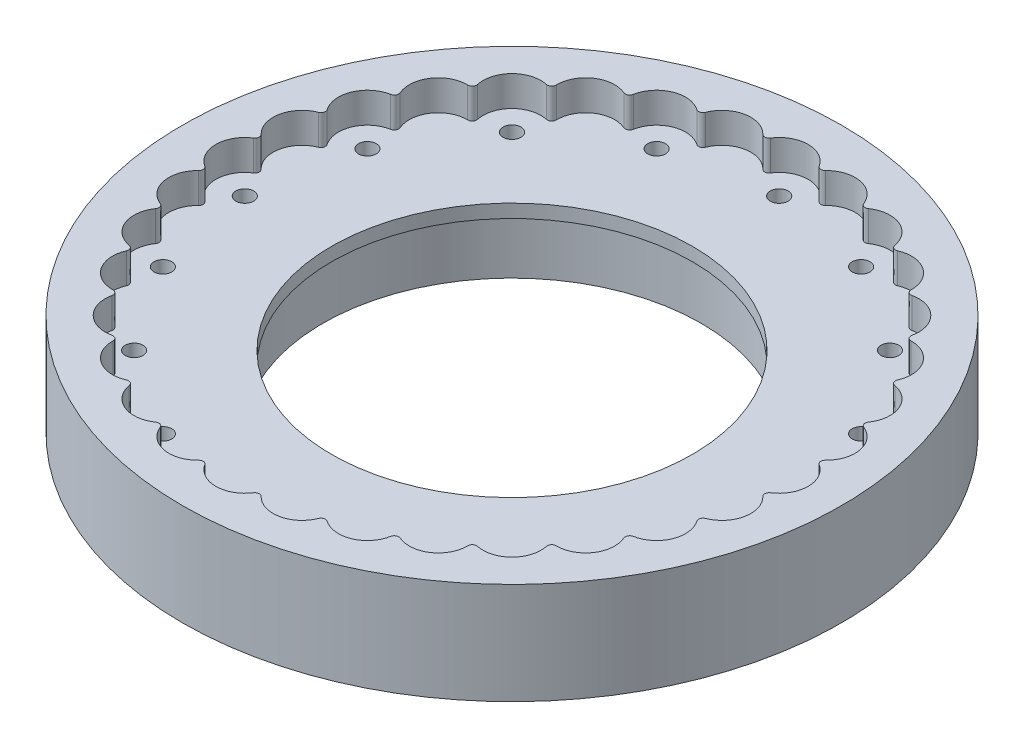
from build123d import *

# Parameters (mm, degrees)
SKETCH_1_R          = 74
EXTRUDE_1_DEPTH     = 6.8
EXTRUDE_START       = 16
SKETCH_2_R          = 74
EXTRUDE_2_DEPTH     = 16
SKETCH_3_R          = 2
CUT_EXTRUDE_1_DEPTH = 16
CUT_EXTRUDE_2_DEPTH = 4.5
FILLET_1_R          = 1
FILLET_2_R          = 1
SKETCH_5_R          = 40.5
CUT_EXTRUDE_5_DEPTH = 110.200915906
SKETCH_6_R          = 42.5
CUT_EXTRUDE_6_DEPTH = 13
SKETCH_8_R          = 2
CUT_EXTRUDE_8_DEPTH = 10


with BuildPart() as part:
    # 草图1 → 凸台-拉伸1 (new body)
    with BuildSketch(Plane(origin=(0, 0, 0), x_dir=(1, 0, 0), z_dir=(0, 1, 0))):
        with Locations(Location((-3, 0, 0), (0, 0, 270))):
            Circle(SKETCH_1_R)
        with BuildLine():
            ThreePointArc((-68.222221147, 12.973506414), (-67.787057046, 9.065890923), (-65.178531856, 6.124050861))
            ThreePointArc((-65.178531856, 6.124050861), (-68.310859491, 3.74763545), (-69.5, 0))
            ThreePointArc((-69.5, 0), (-68.310859491, -3.74763545), (-65.178531856, -6.124050861))
            ThreePointArc((-65.178531856, -6.124050861), (-67.787057046, -9.065890923), (-68.222221147, -12.973506414))
            ThreePointArc((-68.222221147, -12.973506414), (-66.324802233, -16.417142295), (-62.789045747, -18.136808743))
            ThreePointArc((-62.789045747, -18.136808743), (-64.773524332, -21.531020193), (-64.437988912, -25.448448252))
            ThreePointArc((-64.437988912, -25.448448252), (-61.905208337, -28.455747568), (-58.10190014, -29.452579237))
            ThreePointArc((-58.10190014, -29.452579237), (-59.38606972, -33.168724431), (-58.292729218, -36.945420496))
            ThreePointArc((-58.292729218, -36.945420496), (-55.22192032, -39.400814421), (-51.297219412, -39.636503628))
            ThreePointArc((-51.297219412, -39.636503628), (-51.831730071, -43.531773191), (-50.022600949, -47.022600949))
            ThreePointArc((-50.022600949, -47.022600949), (-46.531773191, -48.831730071), (-42.636503628, -48.297219412))
            ThreePointArc((-42.636503628, -48.297219412), (-42.400814421, -52.22192032), (-39.945420496, -55.292729218))
            ThreePointArc((-39.945420496, -55.292729218), (-36.168724431, -56.38606972), (-32.452579237, -55.10190014))
            ThreePointArc((-32.452579237, -55.10190014), (-31.455747568, -58.905208337), (-28.448448252, -61.437988912))
            ThreePointArc((-28.448448252, -61.437988912), (-24.531020193, -61.773524332), (-21.136808743, -59.789045747))
            ThreePointArc((-21.136808743, -59.789045747), (-19.417142295, -63.324802232), (-15.973506414, -65.222221147))
            ThreePointArc((-15.973506414, -65.222221147), (-12.065890923, -64.787057046), (-9.124050861, -62.178531856))
            ThreePointArc((-9.124050861, -62.178531856), (-6.74763545, -65.310859491), (-3, -66.5))
            ThreePointArc((-3, -66.5), (0.74763545, -65.310859491), (3.124050861, -62.178531856))
            ThreePointArc((3.124050861, -62.178531856), (6.065890923, -64.787057046), (9.973506414, -65.222221147))
            ThreePointArc((9.973506414, -65.222221147), (13.417142295, -63.324802232), (15.136808743, -59.789045747))
            ThreePointArc((15.136808743, -59.789045747), (18.531020193, -61.773524332), (22.448448252, -61.437988912))
            ThreePointArc((22.448448252, -61.437988912), (25.455747568, -58.905208337), (26.452579237, -55.10190014))
            ThreePointArc((26.452579237, -55.10190014), (30.168724431, -56.38606972), (33.945420496, -55.292729218))
            ThreePointArc((33.945420496, -55.292729218), (36.400814421, -52.22192032), (36.636503628, -48.297219412))
            ThreePointArc((36.636503628, -48.297219412), (40.531773191, -48.831730071), (44.022600949, -47.022600949))
            ThreePointArc((44.022600949, -47.022600949), (45.831730071, -43.531773191), (45.297219412, -39.636503628))
            ThreePointArc((45.297219412, -39.636503628), (49.22192032, -39.400814421), (52.292729218, -36.945420496))
            ThreePointArc((52.292729218, -36.945420496), (53.38606972, -33.168724431), (52.10190014, -29.452579237))
            ThreePointArc((52.10190014, -29.452579237), (55.905208337, -28.455747568), (58.437988912, -25.448448252))
            ThreePointArc((58.437988912, -25.448448252), (58.773524332, -21.531020193), (56.789045747, -18.136808743))
            ThreePointArc((56.789045747, -18.136808743), (60.324802232, -16.417142295), (62.222221147, -12.973506414))
            ThreePointArc((62.222221147, -12.973506414), (61.787057046, -9.065890923), (59.178531856, -6.124050861))
            ThreePointArc((59.178531856, -6.124050861), (62.310859491, -3.74763545), (63.5, 0))
            ThreePointArc((63.5, 0), (62.310859491, 3.74763545), (59.178531856, 6.124050861))
            ThreePointArc((59.178531856, 6.124050861), (61.787057046, 9.065890923), (62.222221147, 12.973506414))
            ThreePointArc((62.222221147, 12.973506414), (60.324802232, 16.417142295), (56.789045747, 18.136808743))
            ThreePointArc((56.789045747, 18.136808743), (58.773524332, 21.531020193), (58.437988912, 25.448448252))
            ThreePointArc((58.437988912, 25.448448252), (55.905208337, 28.455747568), (52.10190014, 29.452579237))
            ThreePointArc((52.10190014, 29.452579237), (53.38606972, 33.168724431), (52.292729218, 36.945420496))
            ThreePointArc((52.292729218, 36.945420496), (49.22192032, 39.400814421), (45.297219412, 39.636503628))
            ThreePointArc((45.297219412, 39.636503628), (45.831730071, 43.531773191), (44.022600949, 47.022600949))
            ThreePointArc((44.022600949, 47.022600949), (40.531773191, 48.831730071), (36.636503628, 48.297219412))
            ThreePointArc((36.636503628, 48.297219412), (36.400814421, 52.22192032), (33.945420496, 55.292729218))
            ThreePointArc((33.945420496, 55.292729218), (30.168724431, 56.38606972), (26.452579237, 55.10190014))
            ThreePointArc((26.452579237, 55.10190014), (25.455747568, 58.905208337), (22.448448252, 61.437988912))
            ThreePointArc((22.448448252, 61.437988912), (18.531020193, 61.773524332), (15.136808743, 59.789045747))
            ThreePointArc((15.136808743, 59.789045747), (13.417142295, 63.324802232), (9.973506414, 65.222221147))
            ThreePointArc((9.973506414, 65.222221147), (6.065890923, 64.787057046), (3.124050861, 62.178531856))
            ThreePointArc((3.124050861, 62.178531856), (0.74763545, 65.310859491), (-3, 66.5))
            ThreePointArc((-3, 66.5), (-6.74763545, 65.310859491), (-9.124050861, 62.178531856))
            ThreePointArc((-9.124050861, 62.178531856), (-12.065890923, 64.787057046), (-15.973506414, 65.222221147))
            ThreePointArc((-15.973506414, 65.222221147), (-19.417142295, 63.324802232), (-21.136808743, 59.789045747))
            ThreePointArc((-21.136808743, 59.789045747), (-24.531020193, 61.773524332), (-28.448448252, 61.437988912))
            ThreePointArc((-28.448448252, 61.437988912), (-31.455747568, 58.905208337), (-32.452579237, 55.10190014))
            ThreePointArc((-32.452579237, 55.10190014), (-36.168724431, 56.38606972), (-39.945420496, 55.292729218))
            ThreePointArc((-39.945420496, 55.292729218), (-42.400814421, 52.22192032), (-42.636503628, 48.297219412))
            ThreePointArc((-42.636503628, 48.297219412), (-46.531773191, 48.831730071), (-50.022600949, 47.022600949))
            ThreePointArc((-50.022600949, 47.022600949), (-51.831730071, 43.531773191), (-51.297219412, 39.636503628))
            ThreePointArc((-51.297219412, 39.636503628), (-55.22192032, 39.400814421), (-58.292729218, 36.945420496))
            ThreePointArc((-58.292729218, 36.945420496), (-59.38606972, 33.168724431), (-58.10190014, 29.452579237))
            ThreePointArc((-58.10190014, 29.452579237), (-61.905208337, 28.455747568), (-64.437988912, 25.448448252))
            ThreePointArc((-64.437988912, 25.448448252), (-64.773524332, 21.531020193), (-62.789045747, 18.136808743))
            ThreePointArc((-62.789045747, 18.136808743), (-66.324802233, 16.417142295), (-68.222221147, 12.973506414))
        make_face(mode=Mode.SUBTRACT)
    extrude(amount=EXTRUDE_1_DEPTH)

    # 草图2 → 凸台-拉伸2 (add)
    with BuildSketch(Plane.XZ.offset(EXTRUDE_START)):
        with Locations(Location((-3, 0, 0), (0, 0, 270))):
            Circle(SKETCH_2_R)
    extrude(amount=-EXTRUDE_2_DEPTH)

    # 草图3 → 切除-拉伸1 (cut)
    with BuildSketch(Plane(origin=(0, 0, 0), x_dir=(1, 0, 0), z_dir=(0, 1, 0))):
        with Locations(Location((-63, 0, 0), (0, 0, 270))):
            Circle(SKETCH_3_R)
        with Locations(Location((-58.432771951, 22.961005942, 0), (0, 0, 270))):
            Circle(SKETCH_3_R)
        with Locations(Location((-45.426406871, 42.426406871, 0), (0, 0, 270))):
            Circle(SKETCH_3_R)
        with Locations(Location((-25.961005942, 55.432771951, 0), (0, 0, 270))):
            Circle(SKETCH_3_R)
        with Locations(Location((-3, 60, 0), (0, 0, 270))):
            Circle(SKETCH_3_R)
        with Locations(Location((19.961005942, 55.432771951, 0), (0, 0, 270))):
            Circle(SKETCH_3_R)
        with Locations(Location((39.426406871, 42.426406871, 0), (0, 0, 270))):
            Circle(SKETCH_3_R)
        with Locations(Location((52.432771951, 22.961005942, 0), (0, 0, 270))):
            Circle(SKETCH_3_R)
        with Locations(Location((57, 0, 0), (0, 0, 270))):
            Circle(SKETCH_3_R)
        with Locations(Location((52.432771951, -22.961005942, 0), (0, 0, 270))):
            Circle(SKETCH_3_R)
        with Locations(Location((39.426406871, -42.426406871, 0), (0, 0, 270))):
            Circle(SKETCH_3_R)
        with Locations(Location((19.961005942, -55.432771951, 0), (0, 0, 270))):
            Circle(SKETCH_3_R)
        with Locations(Location((-3, -60, 0), (0, 0, 270))):
            Circle(SKETCH_3_R)
        with Locations(Location((-25.961005942, -55.432771951, 0), (0, 0, 270))):
            Circle(SKETCH_3_R)
        with Locations(Location((-45.426406871, -42.426406871, 0), (0, 0, 270))):
            Circle(SKETCH_3_R)
        with Locations(Location((-58.432771951, -22.961005942, 0), (0, 0, 270))):
            Circle(SKETCH_3_R)
    extrude(amount=-CUT_EXTRUDE_1_DEPTH, mode=Mode.SUBTRACT)

    # 草图4 → 切除-拉伸2 (cut)
    with BuildSketch(Plane.XZ.offset(16)):
        Polygon((-61.684875579, 20.46557906), (-57.897720692, 18.896888143), (-54.645617063, 21.392315025), (-55.180668322, 25.456432824), (-58.967823209, 27.025123741), (-62.219926838, 24.529696859), align=None)
        Polygon((-58.900813089, 0), (-60.950406544, 3.55), (-65.049593456, 3.55), (-67.099186911, 0), (-65.049593456, -3.55), (-60.950406544, -3.55), align=None)
        Polygon((-49.385917376, 41.365459229), (-46.487354513, 38.466896367), (-42.527844009, 39.527844009), (-41.466896367, 43.487354513), (-44.365459229, 46.385917376), (-48.324969733, 45.324969733), align=None)
        Polygon((-30.025123741, 55.967823209), (-28.456432824, 52.180668322), (-24.392315025, 51.645617063), (-21.896888143, 54.897720692), (-23.46557906, 58.684875579), (-27.529696859, 59.219926838), align=None)
        Polygon((-6.55, 62.049593456), (-6.55, 57.950406544), (-3, 55.900813089), (0.55, 57.950406544), (0.55, 62.049593456), (-3, 64.099186911), align=None)
        Polygon((17.46557906, 58.684875579), (15.896888143, 54.897720692), (18.392315025, 51.645617063), (22.456432824, 52.180668322), (24.025123741, 55.967823209), (21.529696859, 59.219926838), align=None)
        Polygon((38.365459229, 46.385917376), (35.466896367, 43.487354513), (36.527844009, 39.527844009), (40.487354513, 38.466896367), (43.385917376, 41.365459229), (42.324969733, 45.324969733), align=None)
        Polygon((52.967823209, 27.025123741), (49.180668322, 25.456432824), (48.645617063, 21.392315025), (51.897720692, 18.896888143), (55.684875579, 20.46557906), (56.219926838, 24.529696859), align=None)
        Polygon((59.049593456, 3.55), (54.950406544, 3.55), (52.900813089, 0), (54.950406544, -3.55), (59.049593456, -3.55), (61.099186911, 0), align=None)
        Polygon((55.684875579, -20.46557906), (51.897720692, -18.896888143), (48.645617063, -21.392315025), (49.180668322, -25.456432824), (52.967823209, -27.025123741), (56.219926838, -24.529696859), align=None)
        Polygon((43.385917376, -41.365459229), (40.487354513, -38.466896367), (36.527844009, -39.527844009), (35.466896367, -43.487354513), (38.365459229, -46.385917376), (42.324969733, -45.324969733), align=None)
        Polygon((24.025123741, -55.967823209), (22.456432824, -52.180668322), (18.392315025, -51.645617063), (15.896888143, -54.897720692), (17.46557906, -58.684875579), (21.529696859, -59.219926838), align=None)
        Polygon((0.55, -62.049593456), (0.55, -57.950406544), (-3, -55.900813089), (-6.55, -57.950406544), (-6.55, -62.049593456), (-3, -64.099186911), align=None)
        Polygon((-23.46557906, -58.684875579), (-21.896888143, -54.897720692), (-24.392315025, -51.645617063), (-28.456432824, -52.180668322), (-30.025123741, -55.967823209), (-27.529696859, -59.219926838), align=None)
        Polygon((-44.365459229, -46.385917376), (-41.466896367, -43.487354513), (-42.527844009, -39.527844009), (-46.487354513, -38.466896367), (-49.385917376, -41.365459229), (-48.324969733, -45.324969733), align=None)
        Polygon((-58.967823209, -27.025123741), (-55.180668322, -25.456432824), (-54.645617063, -21.392315025), (-57.897720692, -18.896888143), (-61.684875579, -20.46557906), (-62.219926838, -24.529696859), align=None)
    extrude(amount=-CUT_EXTRUDE_2_DEPTH, mode=Mode.SUBTRACT)

    # 圆角1
    fillet_1_edges = [part.edges().sort_by_distance(p)[0] for p in [
        (36.636503628, 3.4, 48.297219412),
    ]]
    fillet(fillet_1_edges, radius=FILLET_1_R)

    # 圆角2
    fillet_2_edges = [part.edges().sort_by_distance(p)[0] for p in [
        (-65.178531856, 3.4, 6.124050861),
        (-62.789045747, 3.4, 18.136808743),
        (-58.10190014, 3.4, 29.452579237),
        (-51.297219412, 3.4, 39.636503628),
        (-42.636503628, 3.4, 48.297219412),
        (-32.452579237, 3.4, 55.10190014),
        (-21.136808743, 3.4, 59.789045747),
        (-9.124050861, 3.4, 62.178531856),
        (3.124050861, 3.4, 62.178531856),
        (15.136808743, 3.4, 59.789045747),
        (26.452579237, 3.4, 55.10190014),
        (45.297219412, 3.4, 39.636503628),
        (52.10190014, 3.4, 29.452579237),
        (56.789045747, 3.4, 18.136808743),
        (59.178531856, 3.4, 6.124050861),
        (59.178531856, 3.4, -6.124050861),
        (56.789045747, 3.4, -18.136808743),
        (52.10190014, 3.4, -29.452579237),
        (45.297219412, 3.4, -39.636503628),
        (36.636503628, 3.4, -48.297219412),
        (26.452579237, 3.4, -55.10190014),
        (15.136808743, 3.4, -59.789045747),
        (3.124050861, 3.4, -62.178531856),
        (-9.124050861, 3.4, -62.178531856),
        (-21.136808743, 3.4, -59.789045747),
        (-32.452579237, 3.4, -55.10190014),
        (-42.636503628, 3.4, -48.297219412),
        (-51.297219412, 3.4, -39.636503628),
        (-58.10190014, 3.4, -29.452579237),
        (-62.789045747, 3.4, -18.136808743),
        (-65.178531856, 3.4, -6.124050861),
    ]]
    fillet(fillet_2_edges, radius=FILLET_2_R)

    # 草图5 → 切除-拉伸5 (cut, through all)
    with BuildSketch(Plane.XZ.offset(16)):
        with Locations(Location((-3, 0, 0), (0, 0, 270))):
            Circle(SKETCH_5_R)
    extrude(amount=-CUT_EXTRUDE_5_DEPTH, mode=Mode.SUBTRACT)

    # 草图6 → 切除-拉伸6 (cut)
    with BuildSketch(Plane.XZ.offset(16)):
        with Locations(Location((-3, 0, 0), (0, 0, 270))):
            Circle(SKETCH_6_R)
    extrude(amount=-CUT_EXTRUDE_6_DEPTH, mode=Mode.SUBTRACT)

    # 草图8 → 切除-拉伸8 (cut)
    with BuildSketch(Plane.XZ.offset(16)):
        with Locations(Location((-61.828695434, 11.797652036, 0), (0, 0, 270))):
            Circle(SKETCH_8_R)
        with Locations(Location((-52.83586166, 33.412376338, 0), (0, 0, 270))):
            Circle(SKETCH_8_R)
        with Locations(Location((-36.255969713, 49.940369226, 0), (0, 0, 270))):
            Circle(SKETCH_8_R)
        with Locations(Location((-14.613157842, 58.865393611, 0), (0, 0, 270))):
            Circle(SKETCH_8_R)
        with Locations(Location((8.797652036, 58.828695434, 0), (0, 0, 270))):
            Circle(SKETCH_8_R)
        with Locations(Location((30.412376338, 49.83586166, 0), (0, 0, 270))):
            Circle(SKETCH_8_R)
        with Locations(Location((46.940369226, 33.255969713, 0), (0, 0, 270))):
            Circle(SKETCH_8_R)
        with Locations(Location((55.865393611, 11.613157842, 0), (0, 0, 270))):
            Circle(SKETCH_8_R)
        with Locations(Location((55.828695434, -11.797652036, 0), (0, 0, 270))):
            Circle(SKETCH_8_R)
        with Locations(Location((46.83586166, -33.412376338, 0), (0, 0, 270))):
            Circle(SKETCH_8_R)
        with Locations(Location((30.255969713, -49.940369226, 0), (0, 0, 270))):
            Circle(SKETCH_8_R)
        with Locations(Location((8.613157842, -58.865393611, 0), (0, 0, 270))):
            Circle(SKETCH_8_R)
        with Locations(Location((-14.797652036, -58.828695434, 0), (0, 0, 270))):
            Circle(SKETCH_8_R)
        with Locations(Location((-36.412376338, -49.83586166, 0), (0, 0, 270))):
            Circle(SKETCH_8_R)
        with Locations(Location((-52.940369226, -33.255969713, 0), (0, 0, 270))):
            Circle(SKETCH_8_R)
        with Locations(Location((-61.865393611, -11.613157842, 0), (0, 0, 270))):
            Circle(SKETCH_8_R)
    extrude(amount=-CUT_EXTRUDE_8_DEPTH, mode=Mode.SUBTRACT)


solid = part.part
